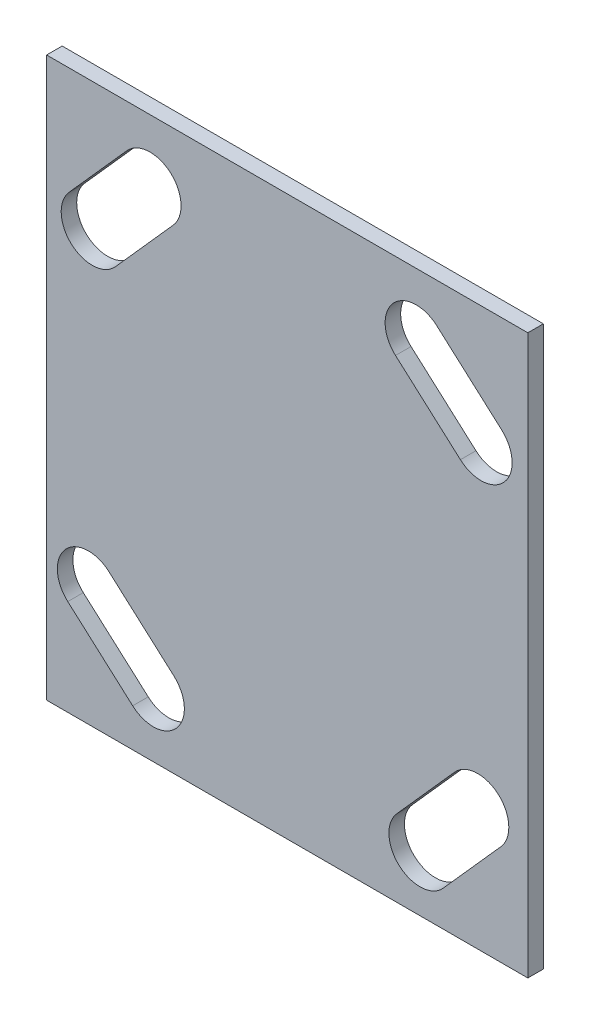
from build123d import *

# Parameters (mm, degrees)
FLAT_PLATE_W       = 98.425
FLAT_PLATE_H       = 114.3
CASTOR_PLATE_DEPTH = 3.175
CUT_EXTRUDE1_DEPTH = 3.175


with BuildPart() as part:
    # Flat Plate → Castor Plate (new body)
    with BuildSketch(Plane.XY):
        with Locations((-52.168585316, -18.955051946)):
            Rectangle(FLAT_PLATE_W, FLAT_PLATE_H)
    extrude(amount=CASTOR_PLATE_DEPTH)

    # Holes → Cut-Extrude1 (cut)
    with BuildSketch(Plane.XY.offset(3.175)):
        with BuildLine():
            Line((-96.801649102, 16.159330585), (-84.977633144, 29.437924132))
            ThreePointArc((-84.977633144, 29.437924132), (-76.012415463, 29.957416129), (-75.492923466, 20.992198448))
            Line((-75.492923466, 20.992198448), (-87.316939425, 7.7136049))
            ThreePointArc((-87.316939425, 7.7136049), (-96.282157106, 7.194112904), (-96.801649102, 16.159330585))
        make_face()
        with BuildLine():
            Line((-29.762145467, -60.410465456), (-17.938129508, -47.131871908))
            ThreePointArc((-17.938129508, -47.131871908), (-8.972911827, -46.612379911), (-8.453419831, -55.577597592))
            Line((-8.453419831, -55.577597592), (-20.27743579, -68.85619114))
            ThreePointArc((-20.27743579, -68.85619114), (-29.242653471, -69.375683136), (-29.762145467, -60.410465456))
        make_face()
        with BuildLine():
            Line((-88.615669415, -46.990896649), (-75.337075868, -58.814912608))
            ThreePointArc((-75.337075868, -58.814912608), (-74.817583871, -67.780130289), (-83.782801552, -68.299622285))
            Line((-83.782801552, -68.299622285), (-97.0613951, -56.475606326))
            ThreePointArc((-97.0613951, -56.475606326), (-97.580887096, -47.510388645), (-88.615669415, -46.990896649))
        make_face()
        with BuildLine():
            Line((-21.57616578, 30.126649102), (-8.297572232, 18.302633144))
            ThreePointArc((-8.297572232, 18.302633144), (-7.778080236, 9.337415463), (-16.743297917, 8.817923466))
            Line((-16.743297917, 8.817923466), (-30.021891465, 20.641939425))
            ThreePointArc((-30.021891465, 20.641939425), (-30.541383461, 29.607157106), (-21.57616578, 30.126649102))
        make_face()
    extrude(amount=-CUT_EXTRUDE1_DEPTH, mode=Mode.SUBTRACT)


solid = part.part
